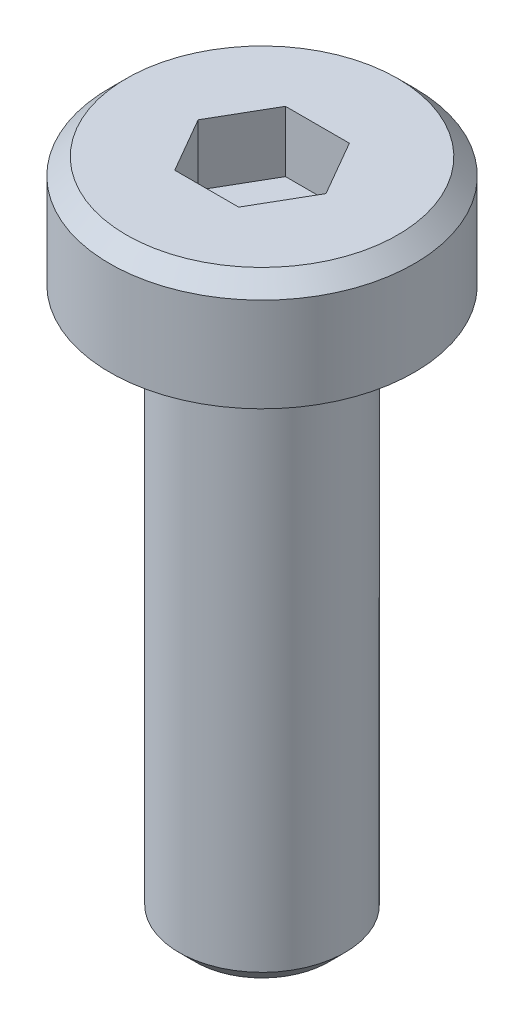
from build123d import *

# Parameters (mm, degrees)
CUT_EXTRUDE_322_DEPTH = 1.1


with BuildPart() as part:
    # Sketch 184 → Revolve 223 (revolve)
    with BuildSketch(Plane.XY, mode=Mode.PRIVATE) as revolve_223_sk:
        Polygon((0, -10), (1.2, -10), (1.5, -9.7), (1.5, 0), (2.75, 0), (2.75, 1.7), (2.45, 2), (0, 2), align=None)
    revolve(revolve_223_sk.sketch.rotate(Axis((0, -12, 0), (0, 1, 0)), 90), axis=Axis((0, -12, 0), (0, 1, 0)))

    # Sketch 274 → Cut-Extrude 322 (cut)
    with BuildSketch(Plane(origin=(0, 2, 0), x_dir=(1, 0, 0), z_dir=(0, 1, 0))):
        Polygon((1.154700538, 0), (0.577350269, 1), (-0.577350269, 1), (-1.154700538, 0), (-0.577350269, -1), (0.577350269, -1), align=None)
    extrude(amount=-CUT_EXTRUDE_322_DEPTH, mode=Mode.SUBTRACT)


solid = part.part
